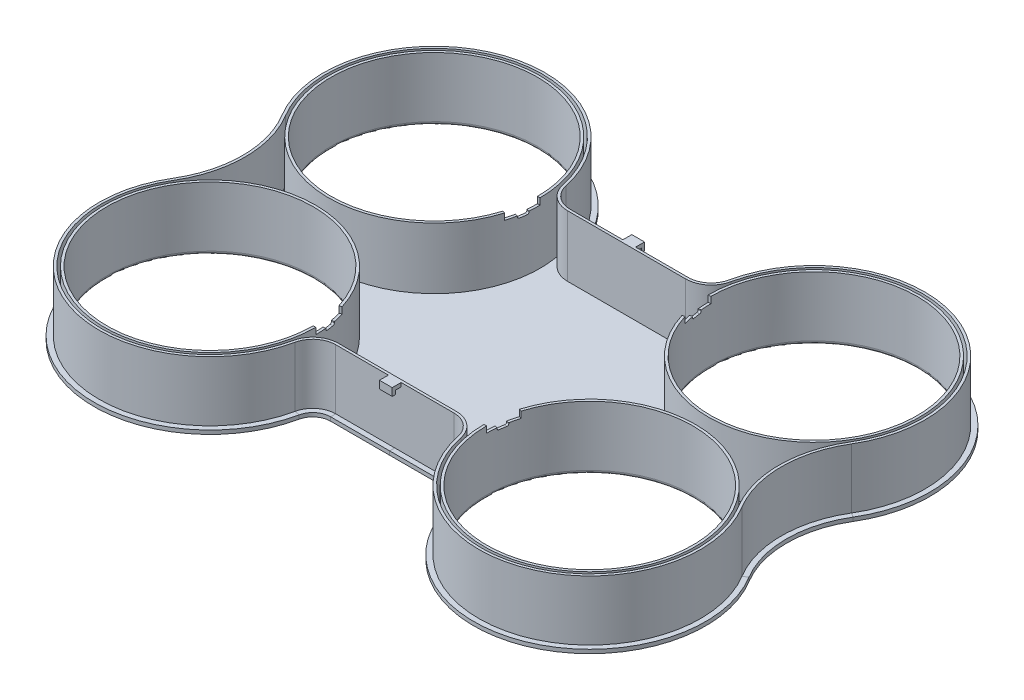
from build123d import *

# Parameters (mm, degrees)
SKETCH1_R                                    = 40.5
BOSS_EXTRUDE1_DEPTH                          = 25
SHELL1_T                                     = -1
FILLET1_R                                    = 1.5
SKETCH2_W                                    = 2
SKETCH2_H                                    = 1.5
ARMCUTSMAIN_START                            = -2.5
ARMCUTSMAIN_DEPTH                            = 2.5
ARMCUTDETAIL_DEPTH                           = 5
ARMCUTDUPES_AT_THE_SECOND_PLANE_COPY_1_DEPTH = 5
HOOKS_DEPTH                                  = 2.5


with BuildPart() as part:
    # Sketch1 → Boss-Extrude1 (new body)
    with BuildSketch(Plane(origin=(0, 0, 0), x_dir=(1, 0, 0), z_dir=(0, 1, 0))):
        with BuildLine():
            Line((-23.165313871, 46), (23.165313871, 46))
            ThreePointArc((23.165313871, 46), (28.82343067, 48.001020483), (31.965545779, 53.114285714))
            ThreePointArc((31.965545779, 53.114285714), (90.537768984, 84.435627435), (111.718349922, 21.482352941))
            ThreePointArc((111.718349922, 21.482352941), (105.725511342, 0), (111.718349922, -21.482352941))
            ThreePointArc((111.718349922, -21.482352941), (90.537768984, -84.435627435), (31.965545779, -53.114285714))
            ThreePointArc((31.965545779, -53.114285714), (28.82343067, -48.001020483), (23.165313871, -46))
            Line((23.165313871, -46), (-23.165313871, -46))
            ThreePointArc((-23.165313871, -46), (-28.82343067, -48.001020483), (-31.965545779, -53.114285714))
            ThreePointArc((-31.965545779, -53.114285714), (-90.537768984, -84.435627435), (-111.718349922, -21.482352941))
            ThreePointArc((-111.718349922, -21.482352941), (-105.725511342, 0), (-111.718349922, 21.482352941))
            ThreePointArc((-111.718349922, 21.482352941), (-90.537768984, 84.435627435), (-31.965545779, 53.114285714))
            ThreePointArc((-31.965545779, 53.114285714), (-28.82343067, 48.001020483), (-23.165313871, 46))
        make_face()
        with Locations((74.5, 44)):
            Circle(SKETCH1_R, mode=Mode.SUBTRACT)
        with Locations((74.5, -44)):
            Circle(SKETCH1_R, mode=Mode.SUBTRACT)
        with Locations((-74.5, -44)):
            Circle(SKETCH1_R, mode=Mode.SUBTRACT)
        with Locations((-74.5, 44)):
            Circle(SKETCH1_R, mode=Mode.SUBTRACT)
    extrude(amount=BOSS_EXTRUDE1_DEPTH)

    # Shell1
    shell1_openings = [part.faces().sort_by_distance(p)[0] for p in [
        (0, 25, 0),
    ]]
    offset(amount=SHELL1_T, openings=shell1_openings, kind=Kind.INTERSECTION)

    # Fillet1
    fillet1_edges = [part.edges().sort_by_distance(p)[0] for p in [
        (34, 0, -44),
        (34, 0, 44),
        (-115, 0, 44),
        (-115, 0, -44),
    ]]
    fillet(fillet1_edges, radius=FILLET1_R)

    # Lip: sweep along a path in Sketch1<2>
    with BuildLine(Plane(origin=(0, 0, 0), x_dir=(1, 0, 0), z_dir=(0, 1, 0))) as lip_path:
        Line((-23.165313871, 46), (23.165313871, 46))
        ThreePointArc((23.165313871, 46), (28.82343067, 48.001020483), (31.965545779, 53.114285714))
        ThreePointArc((31.965545779, 53.114285714), (90.537768984, 84.435627435), (111.718349922, 21.482352941))
        ThreePointArc((111.718349922, 21.482352941), (105.725511342, 0), (111.718349922, -21.482352941))
        ThreePointArc((111.718349922, -21.482352941), (90.537768984, -84.435627435), (31.965545779, -53.114285714))
        ThreePointArc((31.965545779, -53.114285714), (28.82343067, -48.001020483), (23.165313871, -46))
        Line((23.165313871, -46), (-23.165313871, -46))
        ThreePointArc((-23.165313871, -46), (-28.82343067, -48.001020483), (-31.965545779, -53.114285714))
        ThreePointArc((-31.965545779, -53.114285714), (-90.537768984, -84.435627435), (-111.718349922, -21.482352941))
        ThreePointArc((-111.718349922, -21.482352941), (-105.725511342, 0), (-111.718349922, 21.482352941))
        ThreePointArc((-111.718349922, 21.482352941), (-90.537768984, 84.435627435), (-31.965545779, 53.114285714))
        ThreePointArc((-31.965545779, 53.114285714), (-28.82343067, 48.001020483), (-23.165313871, 46))
    # Sketch2 → Lip (sweep)
    with BuildSketch(Plane(origin=(0, 0, 0), x_dir=(0, 0, -1), z_dir=(1, 0, 0))):
        with Locations((-47, 0.75)):
            Rectangle(SKETCH2_W, SKETCH2_H)
    sweep(path=lip_path.line)

    # Sketch3 → ArmCutsMain (cut)
    with BuildSketch(Plane(origin=(0, 25, 0), x_dir=(1, 0, 0), z_dir=(0, 1, 0)).offset(ARMCUTSMAIN_START)):
        with BuildLine():
            Line((33, -44), (74.5, -44))
            Line((74.5, -44), (34.813352628, -31.866574254))
            ThreePointArc((34.813352628, -31.866574254), (33.45584167, -37.865909438), (33, -44))
        make_face()
        with BuildLine():
            Line((-34.813352628, -31.866574254), (-74.5, -44))
            Line((-74.5, -44), (-33, -44))
            ThreePointArc((-33, -44), (-33.45584167, -37.865909438), (-34.813352628, -31.866574254))
        make_face()
        with BuildLine():
            Line((-33, 44), (-74.5, 44))
            Line((-74.5, 44), (-34.813352628, 31.866574254))
            ThreePointArc((-34.813352628, 31.866574254), (-33.45584167, 37.865909438), (-33, 44))
        make_face()
        with BuildLine():
            Line((34.813352628, 31.866574254), (74.5, 44))
            Line((74.5, 44), (33, 44))
            ThreePointArc((33, 44), (33.45584167, 37.865909438), (34.813352628, 31.866574254))
        make_face()
    extrude(amount=ARMCUTSMAIN_DEPTH, mode=Mode.SUBTRACT)

    # Sketch6 → ArmCutDetail (cut)
    with BuildSketch(Plane(origin=(39.689358355, 0, 5.931614349), x_dir=(-0.14780941112961088, 0, 0.9890158633619168), z_dir=(-0.9890158633619167, 0, -0.14780941112961085))):
        with BuildLine():
            Line((34.518615708, 22.5), (30.518615708, 22.5))
            Line((30.518615708, 22.5), (30.518615708, 22.1))
            ThreePointArc((30.518615708, 22.1), (30.694351639, 21.675735931), (31.118615708, 21.5))
            Line((31.118615708, 21.5), (33.918615708, 21.5))
            ThreePointArc((33.918615708, 21.5), (34.342879777, 21.675735931), (34.518615708, 22.1))
            Line((34.518615708, 22.1), (34.518615708, 22.5))
        make_face()
    armcutdetail = extrude(amount=ARMCUTDETAIL_DEPTH, mode=Mode.SUBTRACT)

    # ArmCutDupes: ArmCutDetail across plane
    add(armcutdetail.mirror(Plane(origin=(0, 0, 0), x_dir=(0, 0, 1), z_dir=(1, 0, 0))), mode=Mode.SUBTRACT)

    # ArmCutDupes at the second plane: ArmCutDetail across plane
    add(armcutdetail.mirror(Plane.XY), mode=Mode.SUBTRACT)

    # ArmCutDupes at the second plane copy 1 s → ArmCutDupes at the second plane copy 1 (cut)
    with BuildSketch(Plane(origin=(-39.689358355, 0, -5.931614349), x_dir=(0.14780941112961088, 0, -0.9890158633619168), z_dir=(0.9890158633619167, 0, 0.14780941112961085))):
        with BuildLine():
            Line((34.518615708, 22.5), (30.518615708, 22.5))
            Line((30.518615708, 22.5), (30.518615708, 22.1))
            ThreePointArc((30.518615708, 22.1), (30.694351639, 21.675735931), (31.118615708, 21.5))
            Line((31.118615708, 21.5), (33.918615708, 21.5))
            ThreePointArc((33.918615708, 21.5), (34.342879777, 21.675735931), (34.518615708, 22.1))
            Line((34.518615708, 22.1), (34.518615708, 22.5))
        make_face()
    extrude(amount=ARMCUTDUPES_AT_THE_SECOND_PLANE_COPY_1_DEPTH, mode=Mode.SUBTRACT)

    # Sketch7 → Hooks (add, symmetric)
    with BuildSketch(Plane(origin=(0, 0, 0), x_dir=(0, 0, -1), z_dir=(1, 0, 0))):
        Polygon((46, 25), (49.5, 25), (49.5, 22), (48.25, 22), (48.25, 23.5), (46, 23.5), align=None)
        Polygon((-46, 23.5), (-46, 25), (-49.5, 25), (-49.5, 22), (-48.25, 22), (-48.25, 23.5), align=None)
    extrude(amount=HOOKS_DEPTH, both=True)


solid = part.part
